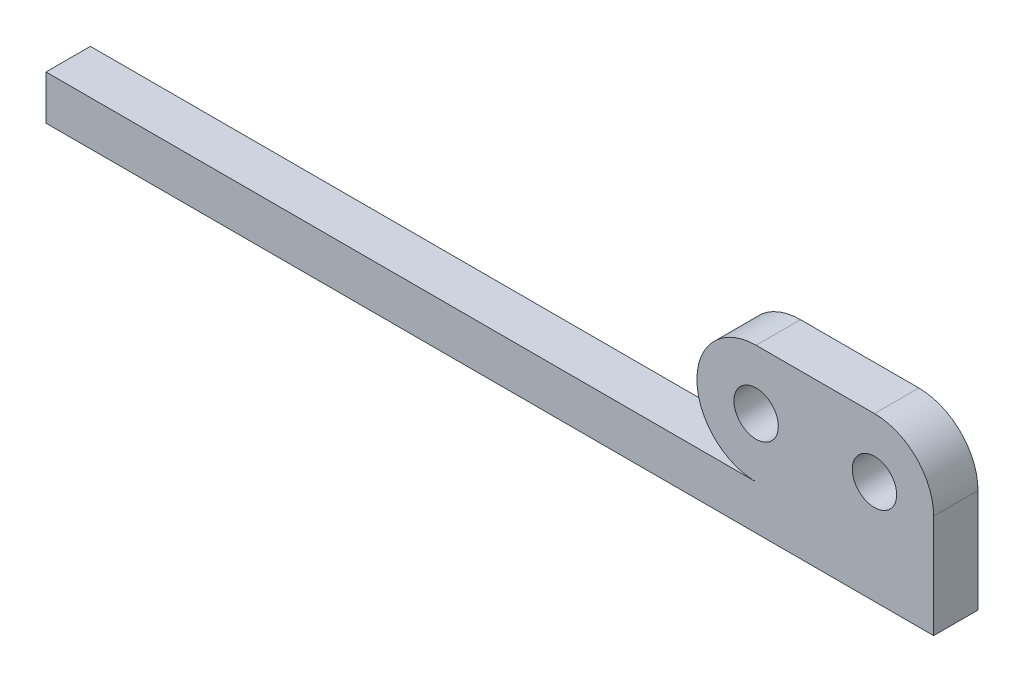
from build123d import *

# Parameters (mm, degrees)
CROQUIS1_R              = 1.5
SALIENTE_EXTRUIR1_DEPTH = 3


with BuildPart() as part:
    # Croquis1 → Saliente-Extruir1 (new body)
    with BuildSketch(Plane.XY):
        with BuildLine():
            Line((0, -4), (-48, -4))
            Line((-48, -4), (-48, -7))
            Line((-48, -7), (12, -7))
            Line((12, -7), (12, 0))
            ThreePointArc((12, 0), (10.828427125, 2.828427125), (8, 4))
            Line((8, 4), (0, 4))
            ThreePointArc((0, 4), (-4, 0), (0, -4))
        make_face()
        Circle(CROQUIS1_R, mode=Mode.SUBTRACT)
        with Locations((8, 0)):
            Circle(CROQUIS1_R, mode=Mode.SUBTRACT)
    extrude(amount=SALIENTE_EXTRUIR1_DEPTH)


solid = part.part
